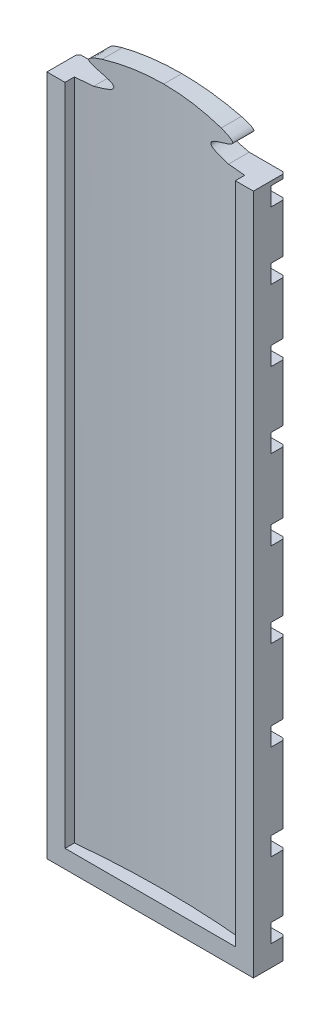
from build123d import *

# Parameters (mm, degrees)
SKETCH2_W               = 73.126
SKETCH2_H               = 465.703533893
BOSS_EXTRUDE1_DEPTH     = 12.8
CUT_EXTRUDE3_DEPTH      = 468.311966945
CUT_EXTRUDE3_DEPTH_BACK = 468.311966945
SKETCH4_W               = 73.126
SKETCH4_H               = 6.4
BOSS_EXTRUDE3_DEPTH     = 12.8
CHAMFER5_SIZE           = 0.7
SKETCH1_W               = 80.142296905
SKETCH1_H               = 6.5
CUT_EXTRUDE4_DEPTH      = 5
SKETCH7_W               = 73.126
SKETCH7_H               = 472.103533893
CUT_EXTRUDE7_DEPTH      = 1.6
CUT_EXTRUDE9_DEPTH      = 468.192117281
CUT_EXTRUDE9_DEPTH_BACK = 468.192117281
SKETCH6_OUTSIDE_W       = 170.698
SKETCH6_OUTSIDE_H       = 569.676


with BuildPart() as part:
    # Sketch2 → Boss-Extrude1 (new body)
    with BuildSketch(Plane.XY):
        with Locations((0, 232.851766947)):
            Rectangle(SKETCH2_W, SKETCH2_H)
    extrude(amount=BOSS_EXTRUDE1_DEPTH)

    # Sketch3 → Cut-Extrude3 (cut, two sides: drawn at the far end of the back side and taken through both)
    with BuildSketch(Plane(origin=(0, 0, 0), x_dir=(1, 0, 0), z_dir=(0, 1, 0)).offset(-CUT_EXTRUDE3_DEPTH_BACK)):
        with BuildLine():
            Line((30.163, -158.685232104), (30.163, -12.8))
            Line((30.163, -12.8), (30.163, -7.896136802))
            ThreePointArc((30.163, -7.896136802), (0, -6.4), (-30.163, -7.896136802))
            Line((-30.163, -7.896136802), (-30.163, -12.8))
            Line((-30.163, -12.8), (-30.163, -158.685232104))
            Line((-30.163, -158.685232104), (-30.163, -450.455696312))
            Line((-30.163, -450.455696312), (30.163, -450.455696312))
            Line((30.163, -450.455696312), (30.163, -158.685232104))
        make_face()
    extrude(amount=CUT_EXTRUDE3_DEPTH + CUT_EXTRUDE3_DEPTH_BACK, mode=Mode.SUBTRACT)

    # Sketch4 → Boss-Extrude3 (add)
    with BuildSketch(Plane.XY):
        with Locations((0, -3.2)):
            Rectangle(SKETCH4_W, SKETCH4_H)
    extrude(amount=BOSS_EXTRUDE3_DEPTH)

    # Chamfer5
    chamfer5_edges = [part.edges().sort_by_distance(p)[0] for p in [
        (0, -6.4, 0),
        (0, 465.703533893, 0),
        (36.563, 229.651766947, 0),
        (-36.563, 229.651766947, 0),
    ]]
    chamfer(chamfer5_edges, length=CHAMFER5_SIZE)

    # Sketch1 → Cut-Extrude4 (cut)
    with BuildSketch(Plane.XY):
        with Locations((0.607494054, 452.05915)):
            Rectangle(SKETCH1_W, SKETCH1_H)
        with Locations((0.607494054, 441.46337)):
            Rectangle(SKETCH1_W, SKETCH1_H)
        with Locations((0.607494054, 64.52931)):
            Rectangle(SKETCH1_W, SKETCH1_H)
        with Locations((0.607494054, 96.28078)):
            Rectangle(SKETCH1_W, SKETCH1_H)
        with Locations((0.607494054, 363.26539)):
            Rectangle(SKETCH1_W, SKETCH1_H)
        with Locations((0.607494054, 154.5375)):
            Rectangle(SKETCH1_W, SKETCH1_H)
        with Locations((0.607494054, 206.43835)):
            Rectangle(SKETCH1_W, SKETCH1_H)
        with Locations((0.607494054, 252.67674)):
            Rectangle(SKETCH1_W, SKETCH1_H)
        with Locations((0.607494054, 293.87047)):
            Rectangle(SKETCH1_W, SKETCH1_H)
        with Locations((0.607494054, 330.56991)):
            Rectangle(SKETCH1_W, SKETCH1_H)
        with Locations((0.607494054, 378.25008)):
            Rectangle(SKETCH1_W, SKETCH1_H)
        with Locations((0.607494054, 405.7436)):
            Rectangle(SKETCH1_W, SKETCH1_H)
        with Locations((0.607494054, 30.88981)):
            Rectangle(SKETCH1_W, SKETCH1_H)
        with Locations((0.607494054, 430.23753)):
            Rectangle(SKETCH1_W, SKETCH1_H)
        with Locations((0.607494054, 418.34417)):
            Rectangle(SKETCH1_W, SKETCH1_H)
        with Locations((0.607494054, 392.39375)):
            Rectangle(SKETCH1_W, SKETCH1_H)
        with Locations((0.607494054, 126.25017)):
            Rectangle(SKETCH1_W, SKETCH1_H)
        with Locations((0.607494054, 347.38966)):
            Rectangle(SKETCH1_W, SKETCH1_H)
        with Locations((0.607494054, 181.23719)):
            Rectangle(SKETCH1_W, SKETCH1_H)
        with Locations((0.607494054, 312.75)):
            Rectangle(SKETCH1_W, SKETCH1_H)
        with Locations((0.607494054, 230.22507)):
            Rectangle(SKETCH1_W, SKETCH1_H)
        with Locations((0.607494054, 273.8683)):
            Rectangle(SKETCH1_W, SKETCH1_H)
        with Locations((0.607494054, 4.25)):
            Rectangle(SKETCH1_W, SKETCH1_H)
    extrude(amount=CUT_EXTRUDE4_DEPTH, mode=Mode.SUBTRACT)

    # Sketch7 → Cut-Extrude7 (cut)
    with BuildSketch(Plane.XY.offset(12.8)):
        with Locations((0, 229.651766947)):
            Rectangle(SKETCH7_W, SKETCH7_H)
    extrude(amount=-CUT_EXTRUDE7_DEPTH, mode=Mode.SUBTRACT)

    # Sketch6 outside → Cut-Extrude9 (cut, two sides: drawn at the far end of the back side and taken through both)
    with BuildSketch(Plane.XY.offset(4).offset(-CUT_EXTRUDE9_DEPTH_BACK)):
        with Locations((0, 229.652)):
            Rectangle(SKETCH6_OUTSIDE_W, SKETCH6_OUTSIDE_H)
        with BuildLine():
            Line((38.819399417, 234.945141086), (23.875711021, 234.945141086))
            add(Edge.make_bspline(
                [(23.875711021, 234.945141086), (23.57868219, 235.008156386), (22.967762055, 235.141319407), (21.889896202, 235.392745421), (20.708006307, 235.699622587), (19.565426894, 236.051588547), (18.669620085, 236.391531629), (18.000077935, 236.723538549), (17.532726482, 237.057642687), (17.238080048, 237.420898724), (17.155859868, 237.862057653), (17.323045698, 238.255585376), (17.722965385, 238.671387524), (18.486906455, 239.119672178), (19.718419799, 239.627217151), (21.128635326, 240.12223713), (22.57152713, 240.617177596), (23.895321508, 241.121717197), (24.945855247, 241.637355325), (25.440657715, 242.073549959), (25.538223572, 242.332905041), (25.524360024, 242.495934735), (25.375884795, 242.740920076), (25.013844295, 243.044876854), (24.42300163, 243.381238767), (23.591118331, 243.741231093), (22.678160648, 244.060298835), (21.821972109, 244.322877898), (21.326065207, 244.463315031), (21.085654319, 244.529034937)],
                knots=[5.5009e-05, 5.5009e-05, 5.5009e-05, 5.5009e-05, 0.015685938, 0.031316866, 0.062578723, 0.09384058, 0.125102437, 0.156364294, 0.187626151, 0.218888008, 0.250149865, 0.281411722, 0.31267358, 0.375197294, 0.437721008, 0.500244722, 0.562768436, 0.62529215, 0.687815864, 0.750339578, 0.781601435, 0.812863292, 0.844125149, 0.875387006, 0.906648863, 0.937910721, 0.969172578, 0.984803506, 1.000434435, 1.000434435, 1.000434435, 1.000434435], degree=3))
            add(Edge.make_bspline(
                [(21.085654319, 244.529034937), (10.752336722, 247.109158832), (0, 247.117941057)],
                knots=[9.444e-06, 9.444e-06, 9.444e-06, 0.999870423, 0.999870423, 0.999870423], degree=2))
            add(Edge.make_bspline(
                [(0, 247.117941057), (-10.752336722, 247.109158832), (-21.085654319, 244.529034937)],
                knots=[9.444e-06, 9.444e-06, 9.444e-06, 0.999870423, 0.999870423, 0.999870423], degree=2))
            add(Edge.make_bspline(
                [(-21.085654319, 244.529034937), (-21.326065207, 244.463315031), (-21.821972109, 244.322877898), (-22.678160648, 244.060298835), (-23.591118331, 243.741231093), (-24.42300163, 243.381238767), (-25.013844295, 243.044876854), (-25.375884795, 242.740920076), (-25.524360024, 242.495934735), (-25.538223572, 242.332905041), (-25.440657715, 242.073549959), (-24.945855247, 241.637355325), (-23.895321508, 241.121717197), (-22.57152713, 240.617177596), (-21.128635326, 240.12223713), (-19.718419799, 239.627217151), (-18.486906455, 239.119672178), (-17.722965385, 238.671387524), (-17.323045698, 238.255585376), (-17.155859868, 237.862057653), (-17.238080048, 237.420898724), (-17.532726482, 237.057642687), (-18.000077935, 236.723538549), (-18.669620085, 236.391531629), (-19.565426894, 236.051588547), (-20.708006307, 235.699622587), (-21.889896202, 235.392745421), (-22.967762055, 235.141319407), (-23.57868219, 235.008156386), (-23.875711021, 234.945141086)],
                knots=[5.5009e-05, 5.5009e-05, 5.5009e-05, 5.5009e-05, 0.015685938, 0.031316866, 0.062578723, 0.09384058, 0.125102437, 0.156364294, 0.187626151, 0.218888008, 0.250149865, 0.31267358, 0.375197294, 0.437721008, 0.500244722, 0.562768436, 0.62529215, 0.687815864, 0.719077721, 0.750339578, 0.781601435, 0.812863292, 0.844125149, 0.875387006, 0.906648863, 0.937910721, 0.969172578, 0.984803506, 1.000434435, 1.000434435, 1.000434435, 1.000434435], degree=3))
            Line((-23.875711021, 234.945141086), (-49.397443722, 234.945141086))
            Line((-49.397443722, 234.945141086), (-43.053491637, -11.00711205))
            Line((-43.053491637, -11.00711205), (38.819399417, -11.00711205))
            Line((38.819399417, -11.00711205), (38.819399417, 234.945141086))
        make_face(mode=Mode.SUBTRACT)
    extrude(amount=CUT_EXTRUDE9_DEPTH + CUT_EXTRUDE9_DEPTH_BACK, mode=Mode.SUBTRACT)


solid = part.part
